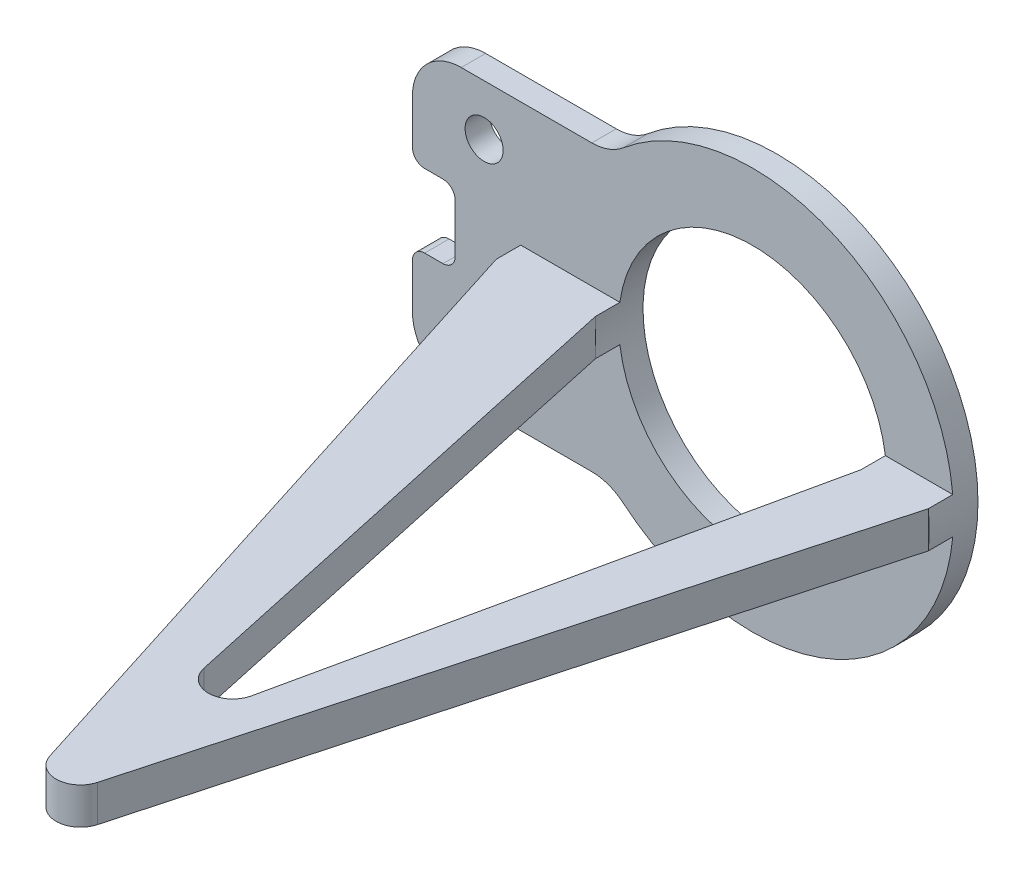
from build123d import *

# Parameters (mm, degrees)
SKETCH_1_R          = 1.56
SKETCH_1_R_2        = 10.981035736
EXTRUDE_1_DEPTH     = 2
EXTRUDE_3_DEPTH     = 2
EXTRUDE_4_DEPTH     = 3
SKETCH_4_W          = 3.5
SKETCH_4_H          = 6
CUT_EXTRUDE_1_DEPTH = 10
FILLET_1_R          = 1
FILLET_2_R          = 1


with BuildPart() as part:
    # 草图1 → 凸台-拉伸1 (new body)
    with BuildSketch(Plane.XY):
        with BuildLine():
            Line((-13.173260362, 11.66726189), (-23.87331228, 11.66726189))
            ThreePointArc((-23.87331228, 11.66726189), (-26.701739405, 10.495689014), (-27.87331228, 7.66726189))
            Line((-27.87331228, 7.66726189), (-27.87331228, -7.66726189))
            ThreePointArc((-27.87331228, -7.66726189), (-26.701739405, -10.495689014), (-23.87331228, -11.66726189))
            Line((-23.87331228, -11.66726189), (-13.173260362, -11.66726189))
            ThreePointArc((-13.173260362, -11.66726189), (-11.803290326, -11.909179653), (-10.599030333, -12.605670839))
            ThreePointArc((-10.599030333, -12.605670839), (16.469437796, 0), (-10.599030333, 12.605670839))
            ThreePointArc((-10.599030333, 12.605670839), (-11.803290326, 11.909179653), (-13.173260362, 11.66726189))
        make_face()
        with Locations((-22, 7.5)):
            Circle(SKETCH_1_R, mode=Mode.SUBTRACT)
        with Locations((-22, -7.5)):
            Circle(SKETCH_1_R, mode=Mode.SUBTRACT)
        Circle(SKETCH_1_R_2, mode=Mode.SUBTRACT)
    extrude(amount=EXTRUDE_1_DEPTH)

    # 草图2 → 凸台-拉伸3 (add)
    with BuildSketch(Plane.XY.offset(2)):
        with BuildLine():
            Line((-19, 1.5), (-10.878103964, 1.5))
            ThreePointArc((-10.878103964, 1.5), (-10.981035736, 0), (-10.878103964, -1.5))
            Line((-10.878103964, -1.5), (-19, -1.5))
            Line((-19, -1.5), (-19, 1.5))
        make_face()
        with BuildLine():
            Line((10.878103964, 1.5), (16.400987206, 1.5))
            ThreePointArc((16.400987206, 1.5), (16.469437796, 0), (16.400987206, -1.5))
            Line((16.400987206, -1.5), (10.878103964, -1.5))
            ThreePointArc((10.878103964, -1.5), (10.981035736, 0), (10.878103964, 1.5))
        make_face()
    extrude(amount=EXTRUDE_3_DEPTH)

    # 草图3 → 凸台-拉伸4 (add)
    with BuildSketch(Plane(origin=(0, 1.5, 0), x_dir=(1, 0, 0), z_dir=(0, 1, 0))):
        with BuildLine():
            Line((-10.878103964, -4), (-1.954283423, -45.017352704))
            ThreePointArc((-1.954283423, -45.017352704), (0, -46.592174739), (1.954283423, -45.017352704))
            Line((1.954283423, -45.017352704), (10.878103964, -4))
            Line((10.878103964, -4), (16.400987206, -4))
            Line((16.400987206, -4), (1.78835733, -57.457623102))
            ThreePointArc((1.78835733, -57.457623102), (-0.101022818, -58.929873662), (-2.047549578, -57.534053964))
            Line((-2.047549578, -57.534053964), (-19, -4))
            Line((-19, -4), (-10.878103964, -4))
        make_face()
    extrude(amount=-EXTRUDE_4_DEPTH)

    # 草图4 → 切除-拉伸1 (cut)
    with BuildSketch(Plane(origin=(0, 0, 0), x_dir=(-1, 0, 0), z_dir=(0, 0, -1))):
        with Locations((26.12331228, 0)):
            Rectangle(SKETCH_4_W, SKETCH_4_H)
    extrude(amount=-CUT_EXTRUDE_1_DEPTH, mode=Mode.SUBTRACT)

    # 圆角1
    fillet_1_edges = [part.edges().sort_by_distance(p)[0] for p in [
        (-27.87331228, 3, 1),
    ]]
    fillet(fillet_1_edges, radius=FILLET_1_R)

    # 圆角2
    fillet_2_edges = [part.edges().sort_by_distance(p)[0] for p in [
        (-24.37331228, 3, 1),
        (-24.37331228, -3, 1),
        (-27.87331228, -3, 1),
    ]]
    fillet(fillet_2_edges, radius=FILLET_2_R)


solid = part.part
